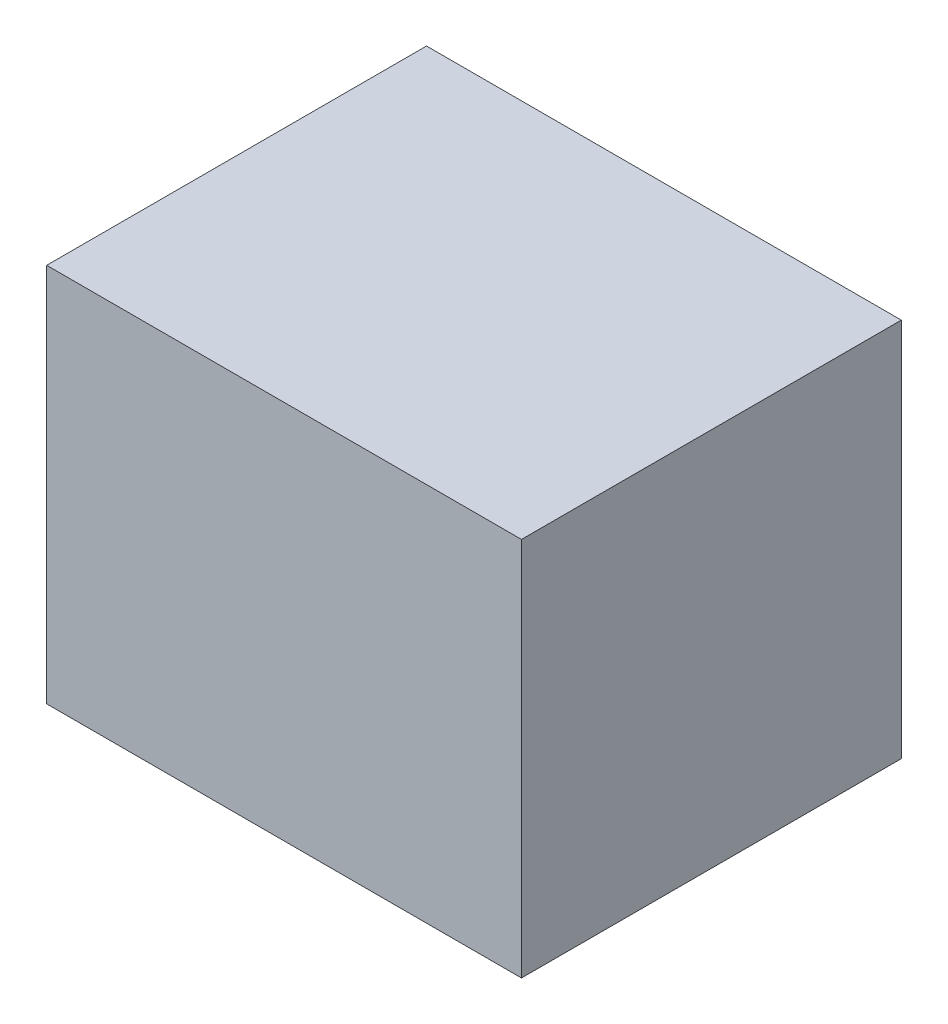
from build123d import *

# Parameters (mm, degrees)
SKETCH1_W           = 127
SKETCH1_H           = 101.6
BOSS_EXTRUDE1_DEPTH = 101.6


with BuildPart() as part:
    # Sketch1 → Boss-Extrude1 (new body)
    with BuildSketch(Plane(origin=(0, 0, 0), x_dir=(1, 0, 0), z_dir=(0, 1, 0))):
        Rectangle(SKETCH1_W, SKETCH1_H)
    extrude(amount=BOSS_EXTRUDE1_DEPTH)


solid = part.part
